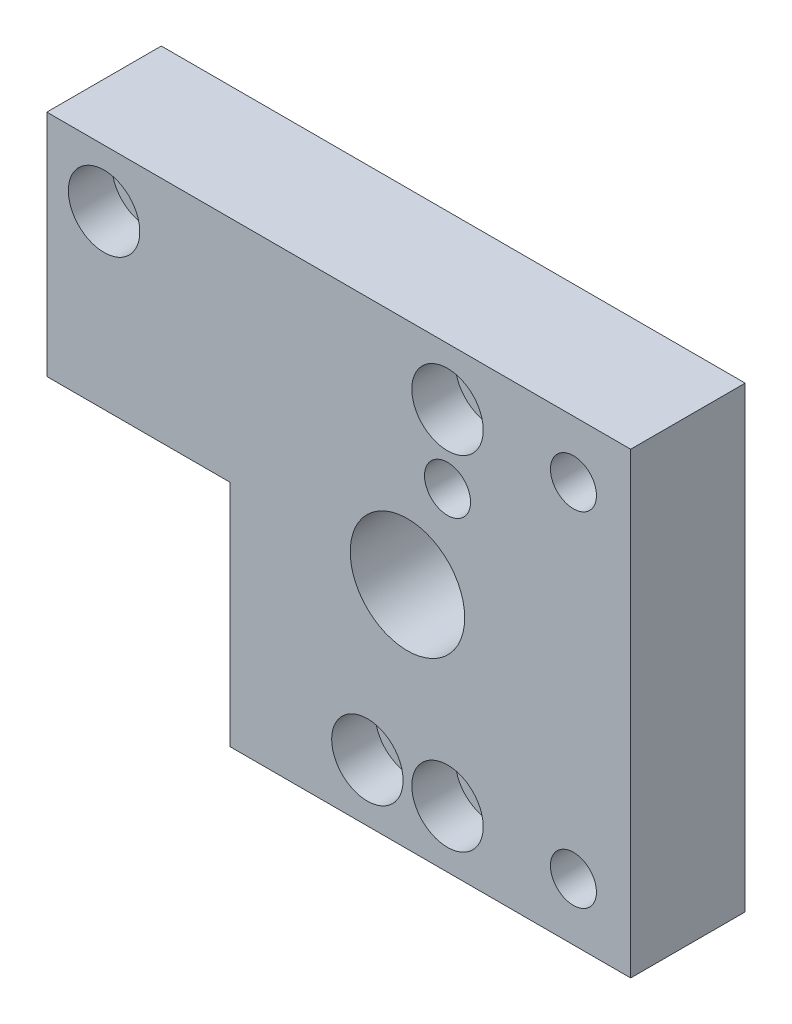
from build123d import *

# Parameters (mm, degrees)
SKETCH1_W                      = 64.77
SKETCH1_H                      = 50.8
SKETCH1_R                      = 2.5527
SKETCH1_R_2                    = 6.35
BOSS_EXTRUDE1_DEPTH            = 12.7
F_7_0_201_DIAMETER_HOLE1_D     = 5.1054
F_7_0_201_DIAMETER_HOLE1_DEPTH = 70.104
F_7_0_201_DIAMETER_HOLE1_TIP   = 1.533816902
SKETCH6_R                      = 3.9624
CUT_EXTRUDE1_DEPTH             = 4.826
SKETCH7_W                      = 20.32
SKETCH7_H                      = 25.4
CUT_EXTRUDE2_DEPTH             = 49.543247728


with BuildPart() as part:
    # Sketch1 → Boss-Extrude1 (new body)
    with BuildSketch(Plane.XY):
        with Locations((6.985, 0)):
            Rectangle(SKETCH1_W, SKETCH1_H)
        with Locations(Location((-19.05, 19.05, 0), (0, 0, 180))):
            Circle(SKETCH1_R, mode=Mode.SUBTRACT)
        with Locations((19.05, 19.05)):
            Circle(SKETCH1_R, mode=Mode.SUBTRACT)
        with Locations((19.05, -19.05)):
            Circle(SKETCH1_R, mode=Mode.SUBTRACT)
        with Locations((10.16, -19.05)):
            Circle(SKETCH1_R, mode=Mode.SUBTRACT)
        with Locations((14.605, 0)):
            Circle(SKETCH1_R_2, mode=Mode.SUBTRACT)
    extrude(amount=BOSS_EXTRUDE1_DEPTH)

    # #7 (0.201) Diameter Hole1
    with Locations(Plane(origin=(-24.721209515, -12.864288698, 0), x_dir=(1, 0, 0), z_dir=(0, 0, -1))):
        with Locations((57.741209515, 6.185711302), (57.741209515, -31.914288698), (43.771209515, -24.294288698)):
            Hole(F_7_0_201_DIAMETER_HOLE1_D / 2, depth=F_7_0_201_DIAMETER_HOLE1_DEPTH)
            with Locations((0, 0, -(F_7_0_201_DIAMETER_HOLE1_DEPTH + F_7_0_201_DIAMETER_HOLE1_TIP / 2))):  # 118° drill point
                Cone(0, F_7_0_201_DIAMETER_HOLE1_D / 2, F_7_0_201_DIAMETER_HOLE1_TIP, mode=Mode.SUBTRACT)

    # Sketch6 → Cut-Extrude1 (cut)
    with BuildSketch(Plane(origin=(0, 0, 12.7), x_dir=(-1, 0, 0), z_dir=(0, 0, -1))):
        with Locations((-19.05, 19.05)):
            Circle(SKETCH6_R)
        with Locations((-19.05, -19.05)):
            Circle(SKETCH6_R)
        with Locations((-10.16, -19.05)):
            Circle(SKETCH6_R)
        with Locations((19.05, 19.05)):
            Circle(SKETCH6_R)
    extrude(amount=CUT_EXTRUDE1_DEPTH, mode=Mode.SUBTRACT)

    # Sketch7 → Cut-Extrude2 (cut, through all)
    with BuildSketch(Plane(origin=(0, 0, 0), x_dir=(-1, 0, 0), z_dir=(0, 0, -1))):
        with Locations((15.24, -12.7)):
            Rectangle(SKETCH7_W, SKETCH7_H)
    extrude(amount=-CUT_EXTRUDE2_DEPTH, mode=Mode.SUBTRACT)


solid = part.part
